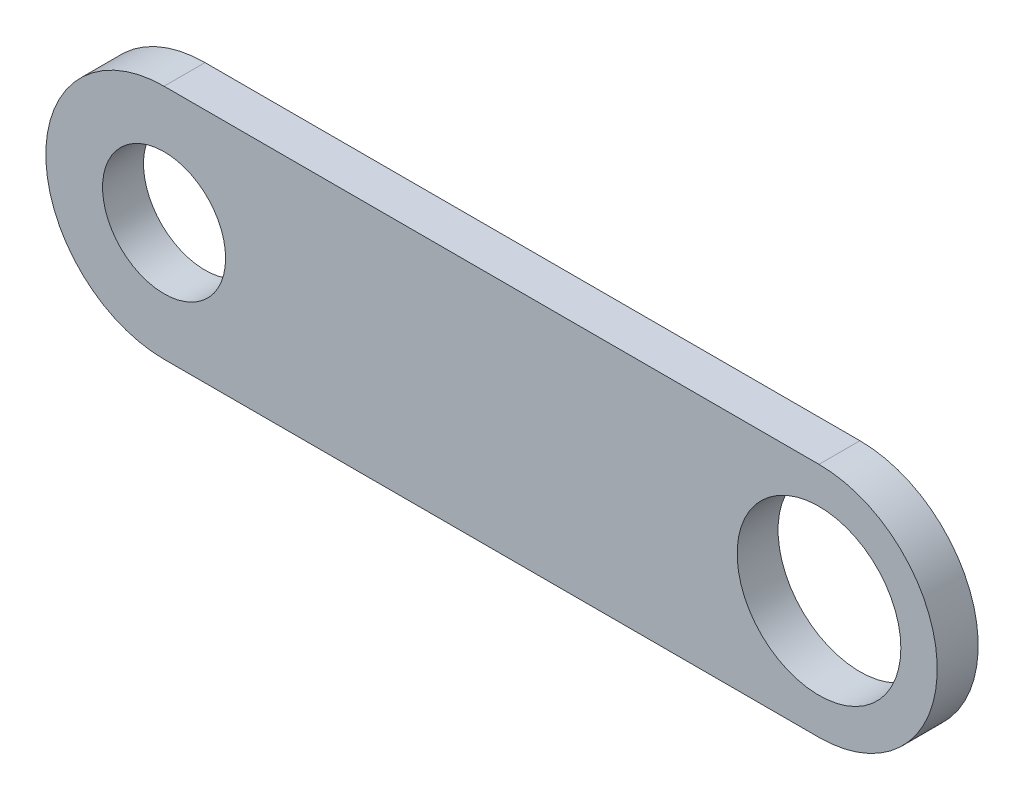
from build123d import *

# Parameters (mm, degrees)
SKETCH1_R           = 9.54405
SKETCH1_R_2         = 12.7
BOSS_EXTRUDE1_DEPTH = 3.175


with BuildPart() as part:
    # Sketch1 → Boss-Extrude1 (new, symmetric)
    with BuildSketch(Plane.XY):
        with BuildLine():
            Line((-50.8, 18.344444444), (50.8, 18.344444444))
            ThreePointArc((50.8, 18.344444444), (69.144444444, 0), (50.8, -18.344444444))
            Line((50.8, -18.344444444), (-50.8, -18.344444444))
            ThreePointArc((-50.8, -18.344444444), (-69.144444444, 0), (-50.8, 18.344444444))
        make_face()
        with Locations((-50.8, 0)):
            Circle(SKETCH1_R, mode=Mode.SUBTRACT)
        with Locations((50.8, 0)):
            Circle(SKETCH1_R_2, mode=Mode.SUBTRACT)
    extrude(amount=BOSS_EXTRUDE1_DEPTH, both=True)


solid = part.part
